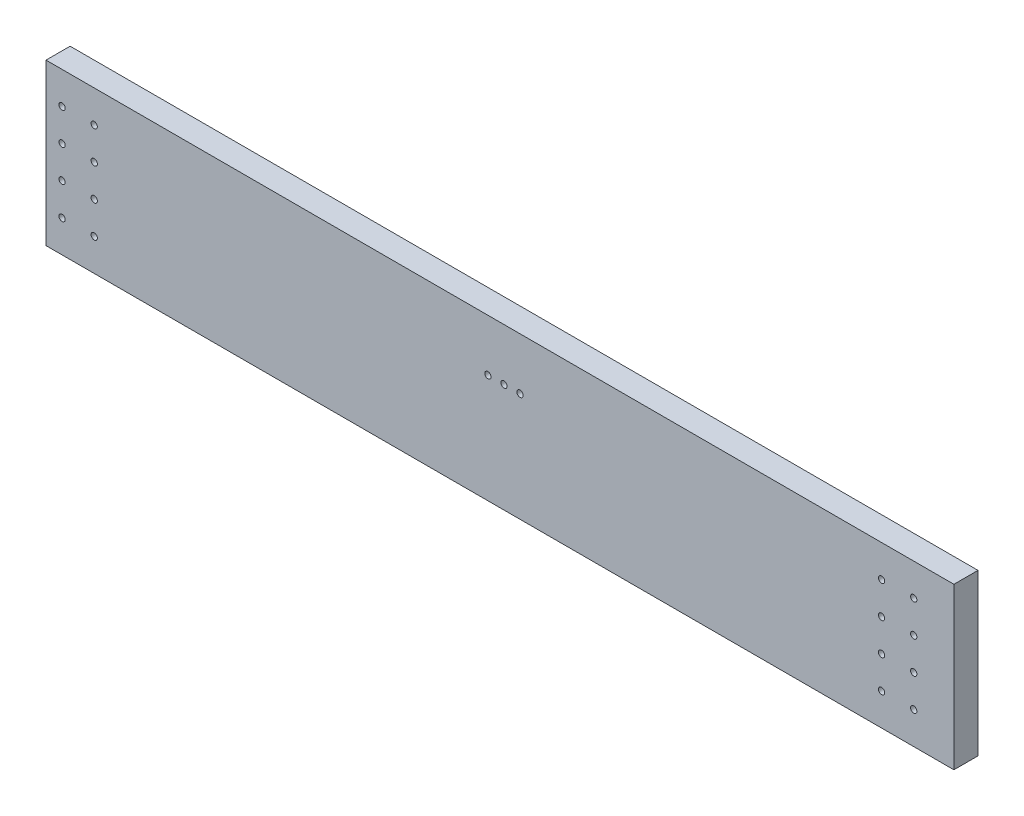
from build123d import *

# Parameters (mm, degrees)
SKETCH1_W           = 717.55
SKETCH1_H           = 127
BOSS_EXTRUDE1_DEPTH = 19.05
SKETCH2_R           = 2.4892
CUT_EXTRUDE1_DEPTH  = 25.4
SKETCH4_R           = 2.4892
CUT_EXTRUDE2_DEPTH  = 729.951236366


with BuildPart() as part:
    # Sketch1 → Boss-Extrude1 (new body)
    with BuildSketch(Plane.XY):
        with Locations((358.775, 63.5)):
            Rectangle(SKETCH1_W, SKETCH1_H)
    extrude(amount=BOSS_EXTRUDE1_DEPTH)

    # Sketch2 → Cut-Extrude1 (cut)
    with BuildSketch(Plane.XY.offset(19.05)):
        with Locations((12.7, 101.6)):
            Circle(SKETCH2_R)
        with Locations((38.1, 101.6)):
            Circle(SKETCH2_R)
        with Locations((38.1, 76.2)):
            Circle(SKETCH2_R)
        with Locations((38.1, 50.8)):
            Circle(SKETCH2_R)
        with Locations((38.1, 25.4)):
            Circle(SKETCH2_R)
        with Locations((12.7, 76.2)):
            Circle(SKETCH2_R)
        with Locations((12.7, 50.8)):
            Circle(SKETCH2_R)
        with Locations((12.7, 25.4)):
            Circle(SKETCH2_R)
        with Locations((685.8, 101.6)):
            Circle(SKETCH2_R)
        with Locations((660.4, 101.6)):
            Circle(SKETCH2_R)
        with Locations((660.4, 76.2)):
            Circle(SKETCH2_R)
        with Locations((660.4, 50.8)):
            Circle(SKETCH2_R)
        with Locations((660.4, 25.4)):
            Circle(SKETCH2_R)
        with Locations((685.8, 76.2)):
            Circle(SKETCH2_R)
        with Locations((685.8, 50.8)):
            Circle(SKETCH2_R)
        with Locations((685.8, 25.4)):
            Circle(SKETCH2_R)
    extrude(amount=-CUT_EXTRUDE1_DEPTH, mode=Mode.SUBTRACT)

    # Sketch4 → Cut-Extrude2 (cut, through all)
    with BuildSketch(Plane.XY.offset(19.05)):
        with Locations((349.25, 85.979)):
            Circle(SKETCH4_R)
        with Locations((361.95, 85.979)):
            Circle(SKETCH4_R)
        with Locations((374.65, 85.979)):
            Circle(SKETCH4_R)
    extrude(amount=-CUT_EXTRUDE2_DEPTH, mode=Mode.SUBTRACT)


solid = part.part
